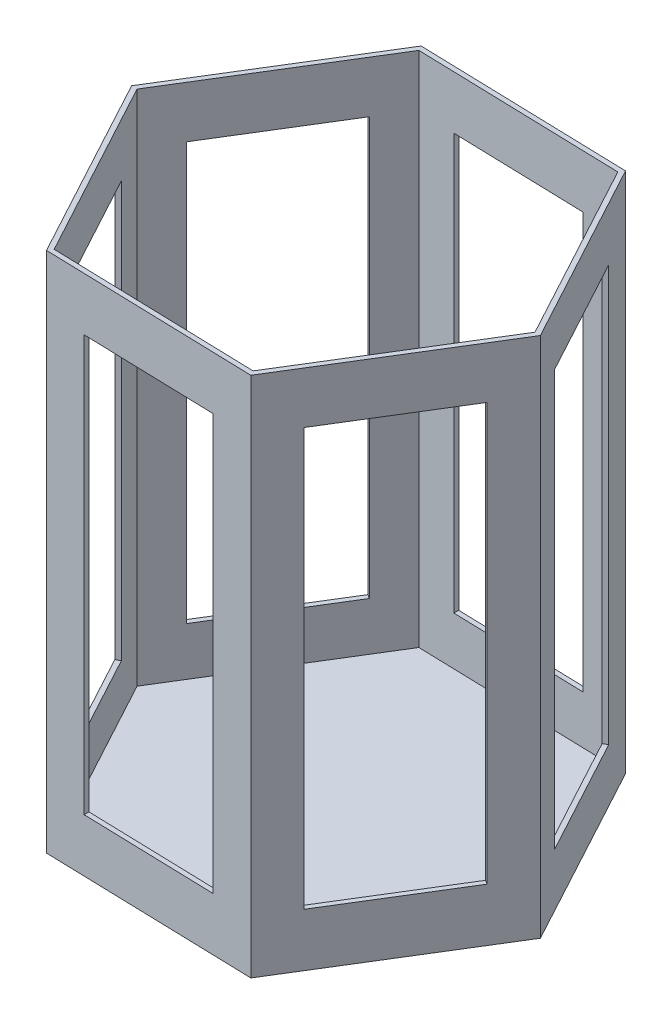
from build123d import *

# Parameters (mm, degrees)
SALIENTE_EXTRUIR1_DEPTH = 215.9
VACIADO2_T              = -2
CROQUIS2_W              = 55
CROQUIS2_H              = 171.9
CORTAR_EXTRUIR1_DEPTH   = 215.9
CROQUIS3_W              = 55
CROQUIS3_H              = 172.561085537
CORTAR_EXTRUIR2_DEPTH   = 215.9
CROQUIS4_W              = 55.15393927
CROQUIS4_H              = 171.9
CORTAR_EXTRUIR3_DEPTH   = 215.9


with BuildPart() as part:
    # Croquis1 → Saliente-Extruir1 (new body)
    with BuildSketch(Plane(origin=(0, 0, 0), x_dir=(1, 0, 0), z_dir=(0, 1, 0))):
        Polygon((-87, 2.4695933), (-45.638730535, -74.109413479), (41.361269465, -76.579006779), (87, -2.4695933), (45.638730535, 74.109413479), (-41.361269465, 76.579006779), align=None)
    extrude(amount=-SALIENTE_EXTRUIR1_DEPTH)

    # Vaciado2
    vaciado2_openings = [part.faces().sort_by_distance(p)[0] for p in [
        (0, 0, 0),
    ]]
    offset(amount=VACIADO2_T, openings=vaciado2_openings, kind=Kind.INTERSECTION)

    # Croquis2 → Cortar-Extruir1 (cut)
    with BuildSketch(Plane(origin=(-2.138730535, 0, 75.344210129), x_dir=(0.9995973571275039, 0, 0.02837470041620955), z_dir=(-0.02837470041620955, 0, 0.9995973571275039))):
        with Locations((0, -107.95)):
            Rectangle(CROQUIS2_W, CROQUIS2_H)
    extrude(amount=-CORTAR_EXTRUIR1_DEPTH, mode=Mode.SUBTRACT)

    # Croquis3 → Cortar-Extruir2 (cut)
    with BuildSketch(Plane(origin=(64.180634732, 0, 39.52430004), x_dir=(0.5243718899489567, 0, -0.8514893546201029), z_dir=(0.8514893546201029, 0, 0.5243718899489567))):
        with Locations((0, -107.619457232)):
            Rectangle(CROQUIS3_W, CROQUIS3_H)
    extrude(amount=-CORTAR_EXTRUIR2_DEPTH, mode=Mode.SUBTRACT)

    # Croquis4 → Cortar-Extruir3 (cut)
    with BuildSketch(Plane(origin=(66.319365268, 0, -35.819910089), x_dir=(-0.47522546717854747, 0, -0.8798640550363058), z_dir=(0.8798640550363059, 0, -0.4752254671785475))):
        with Locations((-1.247199632, -107.95)):
            Rectangle(CROQUIS4_W, CROQUIS4_H)
    extrude(amount=-CORTAR_EXTRUIR3_DEPTH, mode=Mode.SUBTRACT)


solid = part.part
